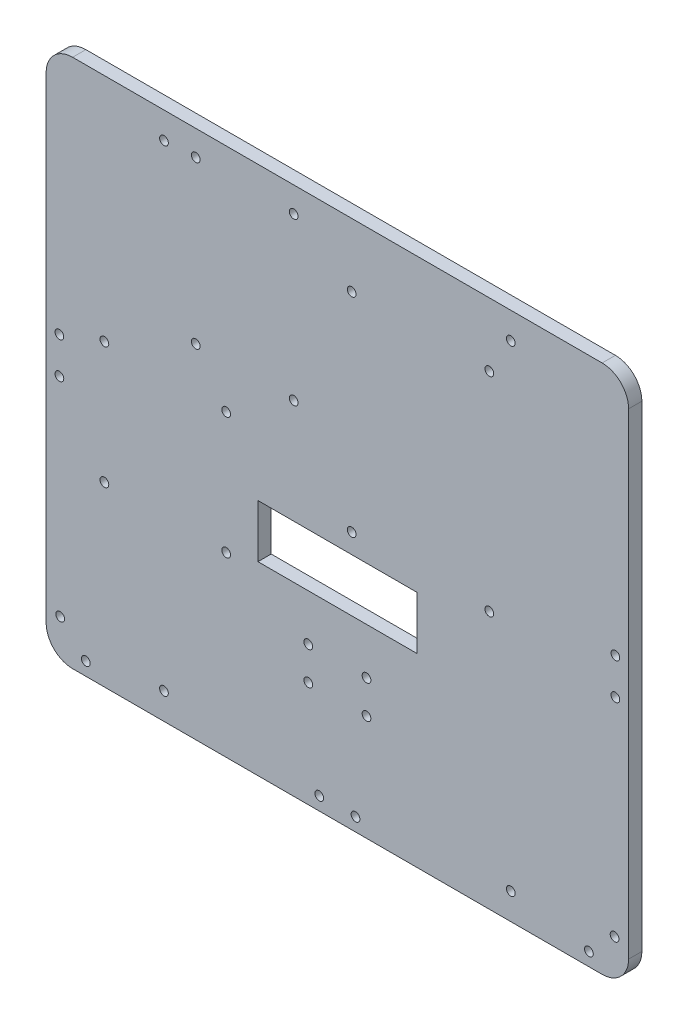
from build123d import *

# Parameters (mm, degrees)
MODEL_R         = 1.65
MODEL_W         = 60
MODEL_H         = 20
EXTRUDE_1_DEPTH = 5


with BuildPart() as part:
    # Model → 凸台-拉伸1 (new body)
    with BuildSketch(Plane.XY):
        with BuildLine():
            Line((196.361294225, 321.408553495), (396.361294225, 321.408553495))
            ThreePointArc((396.361294225, 321.408553495), (403.432362037, 318.479621307), (406.361294225, 311.408553495))
            Line((406.361294225, 311.408553495), (406.361294225, 131.408553495))
            ThreePointArc((406.361294225, 131.408553495), (403.432362037, 124.337485683), (396.361294225, 121.408553495))
            Line((396.361294225, 121.408553495), (196.361294225, 121.408553495))
            ThreePointArc((196.361294225, 121.408553495), (189.290226413, 124.337485683), (186.361294225, 131.408553495))
            Line((186.361294225, 131.408553495), (186.361294225, 311.408553495))
            ThreePointArc((186.361294225, 311.408553495), (189.290226413, 318.479621307), (196.361294225, 321.408553495))
        make_face()
        with Locations((230.861294225, 311.408553495)):
            Circle(MODEL_R, mode=Mode.SUBTRACT)
        with Locations((361.861294225, 311.408553495)):
            Circle(MODEL_R, mode=Mode.SUBTRACT)
        with Locations((230.861294225, 131.408553495)):
            Circle(MODEL_R, mode=Mode.SUBTRACT)
        with Locations((361.861294225, 131.408553495)):
            Circle(MODEL_R, mode=Mode.SUBTRACT)
        with Locations((279.861294225, 311.908553495)):
            Circle(MODEL_R, mode=Mode.SUBTRACT)
        with Locations((279.861294225, 250.908553495)):
            Circle(MODEL_R, mode=Mode.SUBTRACT)
        with Locations((242.861294225, 311.908553495)):
            Circle(MODEL_R, mode=Mode.SUBTRACT)
        with Locations((242.861294225, 250.908553495)):
            Circle(MODEL_R, mode=Mode.SUBTRACT)
        with Locations((208.361294225, 234.408553495)):
            Circle(MODEL_R, mode=Mode.SUBTRACT)
        with Locations((254.361294225, 234.408553495)):
            Circle(MODEL_R, mode=Mode.SUBTRACT)
        with Locations((208.361294225, 188.408553495)):
            Circle(MODEL_R, mode=Mode.SUBTRACT)
        with Locations((254.361294225, 188.408553495)):
            Circle(MODEL_R, mode=Mode.SUBTRACT)
        with Locations((301.761294225, 297.408553495)):
            Circle(MODEL_R, mode=Mode.SUBTRACT)
        with Locations((301.761294225, 218.808553495)):
            Circle(MODEL_R, mode=Mode.SUBTRACT)
        with Locations((353.761294225, 297.408553495)):
            Circle(MODEL_R, mode=Mode.SUBTRACT)
        with Locations((353.761294225, 218.808553495)):
            Circle(MODEL_R, mode=Mode.SUBTRACT)
        with Locations((201.361294225, 126.408553495)):
            Circle(MODEL_R, mode=Mode.SUBTRACT)
        with Locations((191.673931322, 136.095916397)):
            Circle(MODEL_R, mode=Mode.SUBTRACT)
        with Locations((391.361294225, 126.408553495)):
            Circle(MODEL_R, mode=Mode.SUBTRACT)
        with Locations((401.048657127, 136.095916397)):
            Circle(MODEL_R, mode=Mode.SUBTRACT)
        with Locations((289.511294225, 126.408553495)):
            Circle(MODEL_R, mode=Mode.SUBTRACT)
        with Locations((303.211294225, 126.408553495)):
            Circle(MODEL_R, mode=Mode.SUBTRACT)
        with Locations((401.361294225, 228.258553495)):
            Circle(MODEL_R, mode=Mode.SUBTRACT)
        with Locations((401.361294225, 214.558553495)):
            Circle(MODEL_R, mode=Mode.SUBTRACT)
        with Locations((191.361294225, 228.258553495)):
            Circle(MODEL_R, mode=Mode.SUBTRACT)
        with Locations((191.361294225, 214.558553495)):
            Circle(MODEL_R, mode=Mode.SUBTRACT)
        with Locations((285.361294225, 173.908553495)):
            Circle(MODEL_R, mode=Mode.SUBTRACT)
        with Locations((307.361294225, 173.908553495)):
            Circle(MODEL_R, mode=Mode.SUBTRACT)
        with Locations((285.361294225, 161.408553495)):
            Circle(MODEL_R, mode=Mode.SUBTRACT)
        with Locations((307.361294225, 161.408553495)):
            Circle(MODEL_R, mode=Mode.SUBTRACT)
        with Locations((296.361294225, 201.408553495)):
            Rectangle(MODEL_W, MODEL_H, mode=Mode.SUBTRACT)
    extrude(amount=EXTRUDE_1_DEPTH)


solid = part.part
